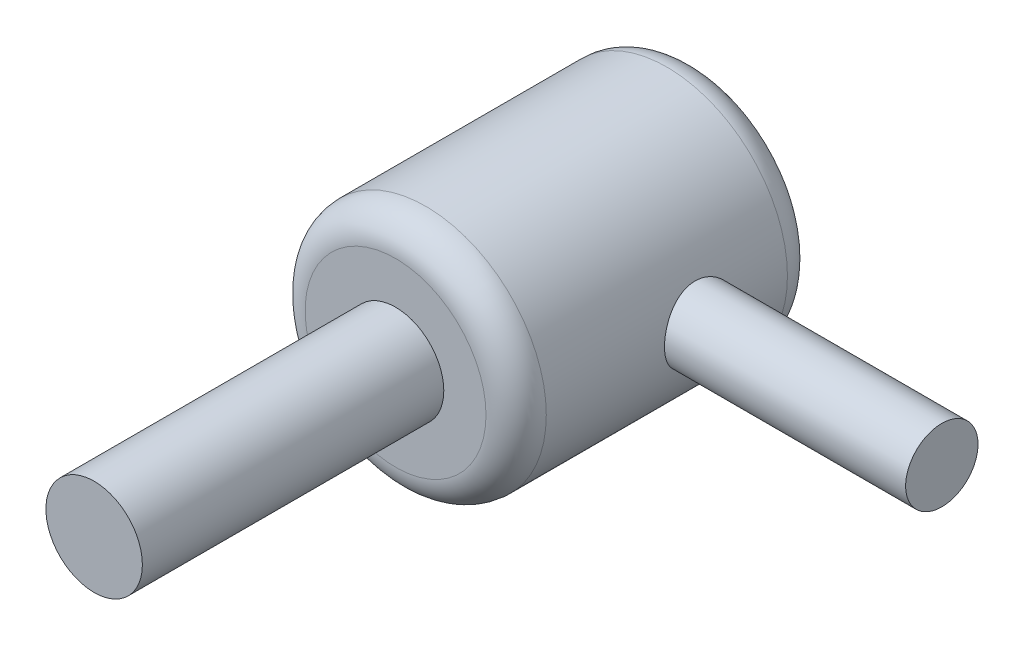
from build123d import *

# Parameters (mm, degrees)
SZKIC1_R                    = 20
DODANIE_WYCI_GNI_CIE1_DEPTH = 50
ZAOKR_GLENIE1_R             = 5
SZKIC2_R                    = 8
DODANIE_WYCI_GNI_CIE2_DEPTH = 50
SZKIC3_R                    = 6
DODANIE_WYCI_GNI_CIE3_DEPTH = 60


with BuildPart() as part:
    # Szkic1 → Dodanie-wyciągnięcie1 (new body)
    with BuildSketch(Plane.XY):
        Circle(SZKIC1_R)
    extrude(amount=DODANIE_WYCI_GNI_CIE1_DEPTH)

    # Zaokrąglenie1
    zaokr_glenie1_edges = [part.edges().sort_by_distance(p)[0] for p in [
        (-20, 0, 0),
        (-20, 0, 50),
    ]]
    fillet(zaokr_glenie1_edges, radius=ZAOKR_GLENIE1_R)

    # Szkic2 → Dodanie-wyciągnięcie2 (add)
    with BuildSketch(Plane.XY.offset(50)):
        Circle(SZKIC2_R)
    extrude(amount=DODANIE_WYCI_GNI_CIE2_DEPTH)

    # Szkic3 → Dodanie-wyciągnięcie3 (add)
    with BuildSketch(Plane(origin=(0, 0, 0), x_dir=(0, 0, -1), z_dir=(1, 0, 0))):
        with Locations((-19.389494998, 0)):
            Circle(SZKIC3_R)
    extrude(amount=DODANIE_WYCI_GNI_CIE3_DEPTH)


solid = part.part
